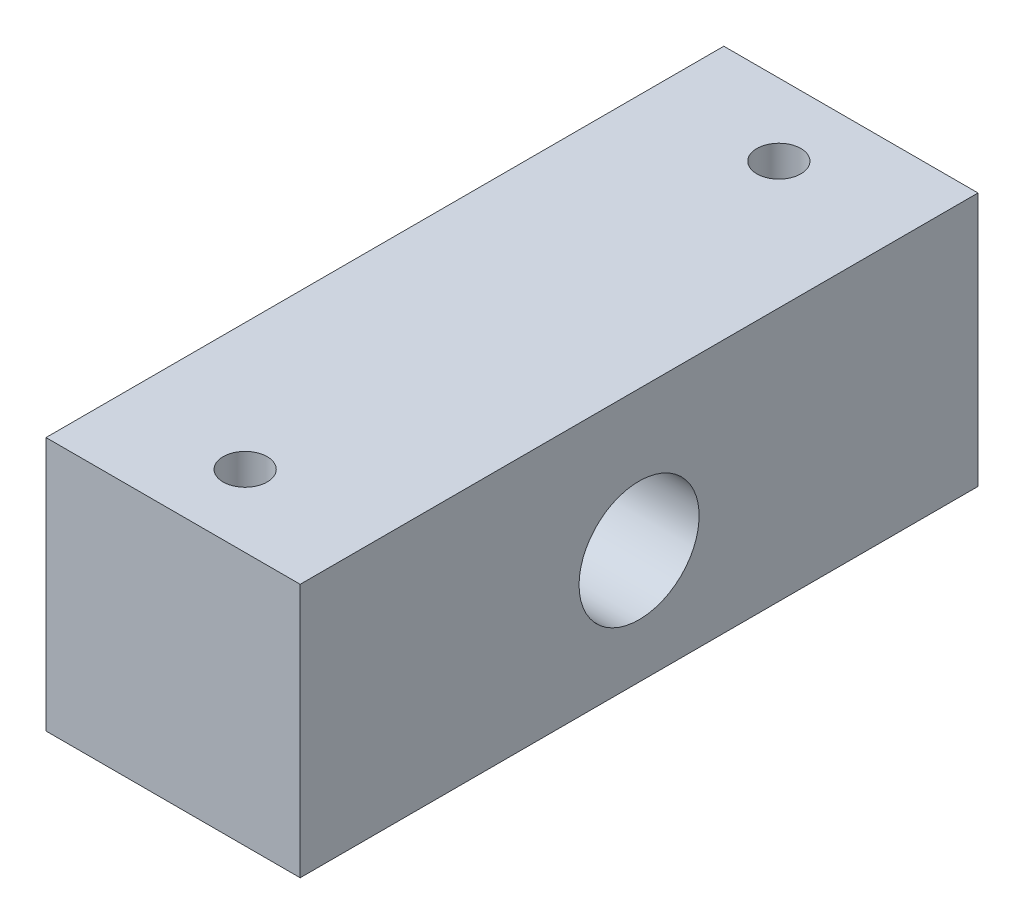
from build123d import *

# Parameters (mm, degrees)
SKETCH1_W                   = 19.05
SKETCH1_H                   = 19.05
BOSS_EXTRUDE1_DEPTH         = 25.4
TAP_DRILL_FOR_M4X0_7_TAP1_D = 3.3
M8_CLEARANCE_HOLE1_D        = 9


with BuildPart() as part:
    # Sketch1 → Boss-Extrude1 (new, symmetric)
    with BuildSketch(Plane.XY):
        Rectangle(SKETCH1_W, SKETCH1_H)
    extrude(amount=BOSS_EXTRUDE1_DEPTH, both=True)

    # Tap Drill for M4x0.7 Tap1 (through all)
    with Locations(Plane(origin=(0, 9.525, 0), x_dir=(1, 0, 0), z_dir=(0, 1, 0))):
        with Locations((0, 20), (0, -20)):
            Hole(TAP_DRILL_FOR_M4X0_7_TAP1_D / 2)

    # M8 Clearance Hole1 (through all)
    with Locations(Plane.ZY.offset(9.525)):
        with Locations((0, -0.975)):
            Hole(M8_CLEARANCE_HOLE1_D / 2)


solid = part.part
